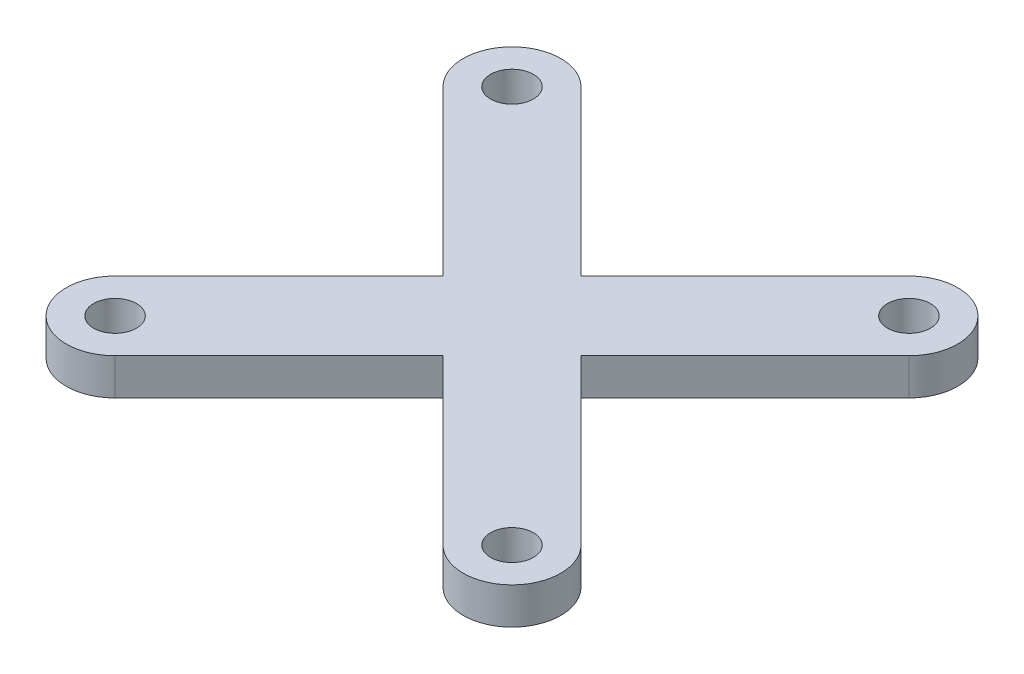
from build123d import *

# Parameters (mm, degrees)
SKETCH1_R                = 11.9
SKETCH1_R_2              = 9.9
BOSS_EXTRUDE3_DEPTH      = 15
SKETCH4_R                = 9.9
BOSS_EXTRUDE4_DEPTH      = 5.1
BOSS_EXTRUDE8_START      = -3
SKETCH12_R               = 19
SKETCH12_R_2             = 11.9
BOSS_EXTRUDE8_DEPTH      = 3
SKETCH14_R               = 1.755
CUT_EXTRUDE4_DEPTH       = 3
CUT_EXTRUDE5_DEPTH       = 25
CUT_EXTRUDE5_DEPTH_BACK  = 20
SKETCH15_W               = 38
SKETCH15_H               = 16.079993569
BOSS_EXTRUDE9_START      = -3
SKETCH16_R               = 9.9
BOSS_EXTRUDE9_DEPTH      = 3
BOSS_EXTRUDE10_START     = -3
SKETCH17_W               = 40
SKETCH17_H               = 40
SKETCH17_R               = 19
BOSS_EXTRUDE10_DEPTH     = 3
SKETCH20_W               = 60
SKETCH20_H               = 60
SKETCH20_W_2             = 40
SKETCH20_H_2             = 40
BOSS_EXTRUDE11_DEPTH     = 3
SKETCH21_R               = 1.755
CUT_EXTRUDE7_DEPTH       = 3
SKETCH23_W               = 60
SKETCH23_H               = 60
CUT_EXTRUDE9_DEPTH       = 3
BOSS_EXTRUDE12_START     = 3
SKETCH24_R               = 1.755
BOSS_EXTRUDE12_DEPTH     = 3
CUT_EXTRUDE10_DEPTH      = 16
CUT_EXTRUDE10_DEPTH_BACK = 42
SKETCH25_W               = 54.545590819
SKETCH25_H               = 6.512587561


with BuildPart() as part:
    # Sketch1 → Boss-Extrude3 (new body)
    with BuildSketch(Plane(origin=(0, 0, 0), x_dir=(1, 0, 0), z_dir=(0, 1, 0))):
        with Locations(Location((0, 0, 0), (0, 0, 270))):
            Circle(SKETCH1_R)
        with Locations(Location((0, 0, 0), (0, 0, 270))):
            Circle(SKETCH1_R_2, mode=Mode.SUBTRACT)
    extrude(amount=BOSS_EXTRUDE3_DEPTH)

    # Sketch4 → Boss-Extrude4 (add)
    with BuildSketch(Plane.XZ):
        with Locations(Location((0, 0, 0), (0, 0, 270))):
            Circle(SKETCH4_R)
    extrude(amount=-BOSS_EXTRUDE4_DEPTH)

    # Sketch7 → Cut-Revolve2 (revolve, cut)
    with BuildSketch(Plane(origin=(0, 0, 0), x_dir=(0, 0, -1), z_dir=(1, 0, 0))):
        with BuildLine():
            Line((0, 15), (0, -4.8))
            ThreePointArc((0, -4.8), (9.9, 5.1), (0, 15))
        make_face()
    revolve(axis=Axis((0, 15, 0), (0, -1, 0)), mode=Mode.SUBTRACT)

    # Sketch12 → Boss-Extrude8 (add)
    with BuildSketch(Plane(origin=(0, 15, 0), x_dir=(1, 0, 0), z_dir=(0, 1, 0)).offset(BOSS_EXTRUDE8_START)):
        with Locations(Location((0, 0, 0), (0, 0, 270))):
            Circle(SKETCH12_R)
        with Locations(Location((0, 0, 0), (0, 0, 270))):
            Circle(SKETCH12_R_2, mode=Mode.SUBTRACT)
    extrude(amount=BOSS_EXTRUDE8_DEPTH)

    # Sketch14 → Cut-Extrude4 (cut)
    with BuildSketch(Plane(origin=(0, 15, 0), x_dir=(1, 0, 0), z_dir=(0, 1, 0))):
        with Locations(Location((0, 15.15, 0), (0, 0, 270))):
            Circle(SKETCH14_R)
        with Locations(Location((-15.15, 0, 0), (0, 0, 270))):
            Circle(SKETCH14_R)
        with Locations(Location((0, -15.15, 0), (0, 0, 270))):
            Circle(SKETCH14_R)
        with Locations(Location((15.15, 0, 0), (0, 0, 270))):
            Circle(SKETCH14_R)
    extrude(amount=-CUT_EXTRUDE4_DEPTH, mode=Mode.SUBTRACT)

    # Sketch15 → Cut-Extrude5 (cut, two sides: drawn at the far end of the back side and taken through both)
    with BuildSketch(Plane(origin=(0, 0, 0), x_dir=(0, 0, -1), z_dir=(1, 0, 0)).offset(-CUT_EXTRUDE5_DEPTH_BACK)):
        with Locations((0, 3.960003216)):
            Rectangle(SKETCH15_W, SKETCH15_H)
    extrude(amount=CUT_EXTRUDE5_DEPTH + CUT_EXTRUDE5_DEPTH_BACK, mode=Mode.SUBTRACT)

    # Sketch16 → Boss-Extrude9 (add)
    with BuildSketch(Plane(origin=(0, 15, 0), x_dir=(1, 0, 0), z_dir=(0, 1, 0)).offset(BOSS_EXTRUDE9_START)):
        Circle(SKETCH16_R)
    extrude(amount=BOSS_EXTRUDE9_DEPTH)

    # Sketch17 → Boss-Extrude10 (add)
    with BuildSketch(Plane(origin=(0, 15, 0), x_dir=(1, 0, 0), z_dir=(0, 1, 0)).offset(BOSS_EXTRUDE10_START)):
        Rectangle(SKETCH17_W, SKETCH17_H)
        Circle(SKETCH17_R, mode=Mode.SUBTRACT)
    extrude(amount=BOSS_EXTRUDE10_DEPTH)

    # Sketch20 → Boss-Extrude11 (add)
    with BuildSketch(Plane(origin=(0, 15, 0), x_dir=(1, 0, 0), z_dir=(0, 1, 0))):
        Rectangle(SKETCH20_W, SKETCH20_H)
        Rectangle(SKETCH20_W_2, SKETCH20_H_2, mode=Mode.SUBTRACT)
    extrude(amount=-BOSS_EXTRUDE11_DEPTH)

    # Sketch21 → Cut-Extrude7 (cut)
    with BuildSketch(Plane(origin=(0, 15, 0), x_dir=(1, 0, 0), z_dir=(0, 1, 0))):
        with Locations(Location((-16.263455967, 16.263455967, 0), (0, 0, 270))):
            Circle(SKETCH21_R)
        with Locations(Location((-16.263455967, -16.263455967, 0), (0, 0, 270))):
            Circle(SKETCH21_R)
        with Locations(Location((16.263455967, 16.263455967, 0), (0, 0, 270))):
            Circle(SKETCH21_R)
        with Locations(Location((16.263455967, -16.263455967, 0), (0, 0, 270))):
            Circle(SKETCH21_R)
    extrude(amount=-CUT_EXTRUDE7_DEPTH, mode=Mode.SUBTRACT)

    # Sketch23 → Cut-Extrude9 (cut)
    with BuildSketch(Plane(origin=(0, 15, 0), x_dir=(1, 0, 0), z_dir=(0, 1, 0))):
        Rectangle(SKETCH23_W, SKETCH23_H)
        with BuildLine():
            Line((-20.263455967, -16.263455967), (-20.263455967, 16.263455967))
            ThreePointArc((-20.263455967, 16.263455967), (-19.091883092, 19.091883092), (-16.263455967, 20.263455967))
            Line((-16.263455967, 20.263455967), (16.263455967, 20.263455967))
            ThreePointArc((16.263455967, 20.263455967), (19.091883092, 19.091883092), (20.263455967, 16.263455967))
            Line((20.263455967, 16.263455967), (20.263455967, -16.263455967))
            ThreePointArc((20.263455967, -16.263455967), (19.091883092, -19.091883092), (16.263455967, -20.263455967))
            Line((16.263455967, -20.263455967), (-16.263455967, -20.263455967))
            ThreePointArc((-16.263455967, -20.263455967), (-19.091883092, -19.091883092), (-20.263455967, -16.263455967))
        make_face(mode=Mode.SUBTRACT)
    extrude(amount=-CUT_EXTRUDE9_DEPTH, mode=Mode.SUBTRACT)

    # Sketch24 → Boss-Extrude12 (add)
    with BuildSketch(Plane(origin=(0, 15, 0), x_dir=(1, 0, 0), z_dir=(0, 1, 0)).offset(BOSS_EXTRUDE12_START)):
        with BuildLine():
            Line((-19.091883092, 13.435028843), (-5.656854249, 0))
            Line((-5.656854249, 0), (-19.091883092, -13.435028843))
            ThreePointArc((-19.091883092, -13.435028843), (-19.091883092, -19.091883092), (-13.435028843, -19.091883092))
            Line((-13.435028843, -19.091883092), (0, -5.656854249))
            Line((0, -5.656854249), (13.435028843, -19.091883092))
            ThreePointArc((13.435028843, -19.091883092), (19.091883092, -19.091883092), (19.091883092, -13.435028843))
            Line((19.091883092, -13.435028843), (5.656854249, 0))
            Line((5.656854249, 0), (19.091883092, 13.435028843))
            ThreePointArc((19.091883092, 13.435028843), (19.091883092, 19.091883092), (13.435028843, 19.091883092))
            Line((13.435028843, 19.091883092), (0, 5.656854249))
            Line((0, 5.656854249), (-13.435028843, 19.091883092))
            ThreePointArc((-13.435028843, 19.091883092), (-19.091883092, 19.091883092), (-19.091883092, 13.435028843))
        make_face()
        with Locations(Location((-16.263455967, 16.263455967, 0), (0, 0, 270))):
            Circle(SKETCH24_R, mode=Mode.SUBTRACT)
        with Locations(Location((16.263455967, 16.263455967, 0), (0, 0, 270))):
            Circle(SKETCH24_R, mode=Mode.SUBTRACT)
        with Locations(Location((16.263455967, -16.263455967, 0), (0, 0, 270))):
            Circle(SKETCH24_R, mode=Mode.SUBTRACT)
        with Locations(Location((-16.263455967, -16.263455967, 0), (0, 0, 270))):
            Circle(SKETCH24_R, mode=Mode.SUBTRACT)
    extrude(amount=-BOSS_EXTRUDE12_DEPTH)

    # Sketch25 → Cut-Extrude10 (cut, two sides: drawn at the far end of the back side and taken through both)
    with BuildSketch(Plane.XY.offset(20.263455967).offset(-CUT_EXTRUDE10_DEPTH_BACK)):
        with Locations((4.016045733, 11.74370622)):
            Rectangle(SKETCH25_W, SKETCH25_H)
    extrude(amount=CUT_EXTRUDE10_DEPTH + CUT_EXTRUDE10_DEPTH_BACK, mode=Mode.SUBTRACT)


solid = part.part
